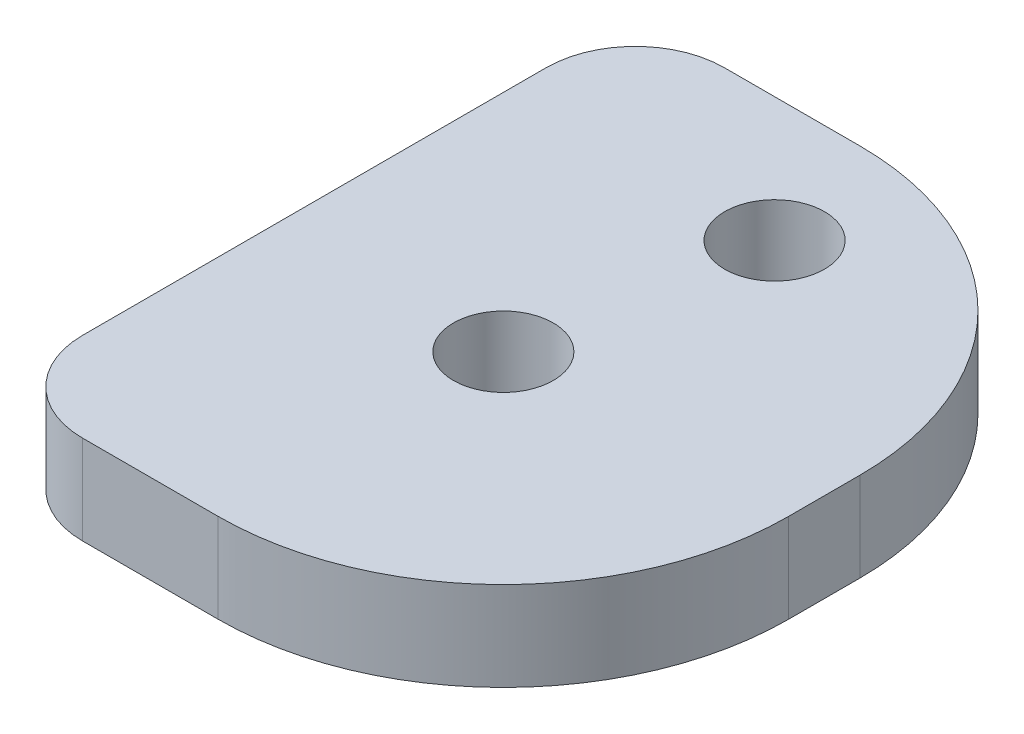
from build123d import *

# Parameters (mm, degrees)
SKETCH1_W           = 50.8
SKETCH1_H           = 22.86
BOSS_EXTRUDE1_DEPTH = 3.175
FILLET1_R           = 10.16
SKETCH3_R           = 1.778
CUT_EXTRUDE1_DEPTH  = 29.033649869
FILLET3_R           = 10.16
SKETCH4_W           = 32.639
SKETCH4_H           = 22.86
CUT_EXTRUDE2_DEPTH  = 29.033649869
FILLET9_R           = 3.175


with BuildPart() as part:
    # Sketch1 → Boss-Extrude1 (new body)
    with BuildSketch(Plane(origin=(0, 0, 0), x_dir=(1, 0, 0), z_dir=(0, 1, 0))):
        Rectangle(SKETCH1_W, SKETCH1_H)
    extrude(amount=BOSS_EXTRUDE1_DEPTH)

    # Fillet1
    fillet1_edges = [part.edges().sort_by_distance(p)[0] for p in [
        (25.4, 1.5875, 11.43),
        (-25.4, 1.5875, 11.43),
    ]]
    fillet(fillet1_edges, radius=FILLET1_R)

    # Sketch3 → Cut-Extrude1 (cut, through all)
    with BuildSketch(Plane(origin=(0, 3.175, 0), x_dir=(1, 0, 0), z_dir=(0, 1, 0))):
        with Locations(Location((15.24, -1.27, 0), (0, 0, 270))):
            Circle(SKETCH3_R)
        with Locations(Location((16.637, 6.994763457, 0), (0, 0, 270))):
            Circle(SKETCH3_R)
        with Locations(Location((-3.81, -1.27, 0), (0, 0, 270))):
            Circle(SKETCH3_R)
    extrude(amount=-CUT_EXTRUDE1_DEPTH, mode=Mode.SUBTRACT)

    # Fillet3
    fillet3_edges = [part.edges().sort_by_distance(p)[0] for p in [
        (-25.4, 1.5875, -11.43),
        (25.4, 1.5875, -11.43),
    ]]
    fillet(fillet3_edges, radius=FILLET3_R)

    # Sketch4 → Cut-Extrude2 (cut, through all)
    with BuildSketch(Plane(origin=(0, 3.175, 0), x_dir=(1, 0, 0), z_dir=(0, 1, 0))):
        with Locations((-9.0805, 0)):
            Rectangle(SKETCH4_W, SKETCH4_H)
    extrude(amount=-CUT_EXTRUDE2_DEPTH, mode=Mode.SUBTRACT)

    # Fillet9
    fillet9_edges = [part.edges().sort_by_distance(p)[0] for p in [
        (7.239, 1.5875, -11.43),
        (7.239, 1.5875, 11.43),
    ]]
    fillet(fillet9_edges, radius=FILLET9_R)


solid = part.part
